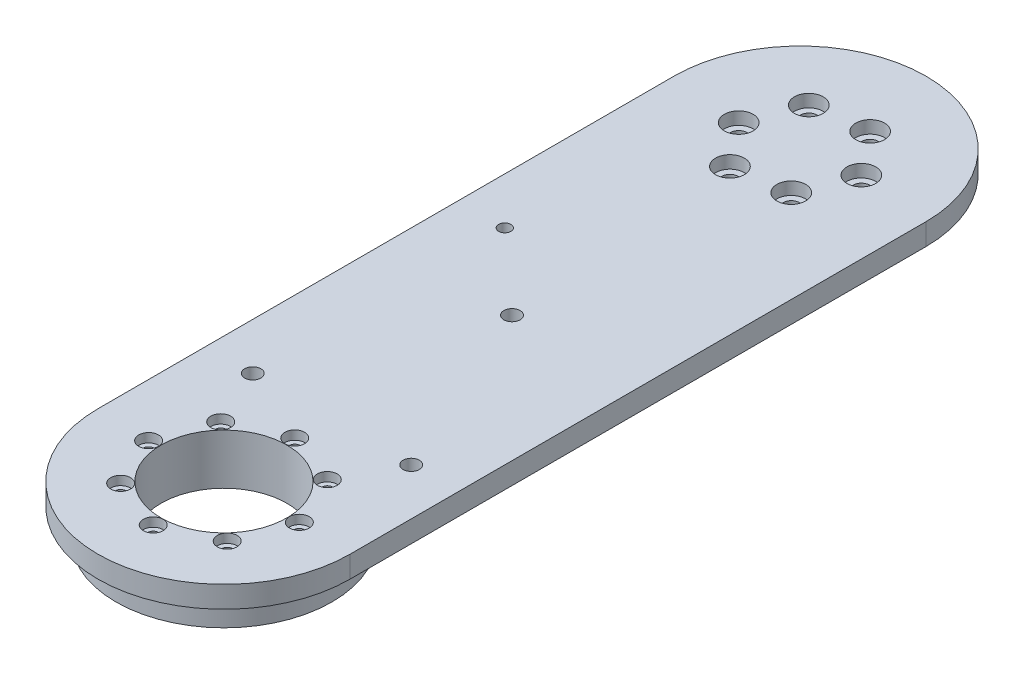
from build123d import *

# Parameters (mm, degrees)
PLACA_START                    = 46.75
SK_PLACA_W                     = 70
SK_PLACA_H                     = 160
PLACA_DEPTH                    = 6
EXTREMOS_START                 = 46.75
SK_EXTREMOS_R                  = 35
EXTREMOS_DEPTH                 = 6
PASANTES_M4_SEPARADORES_START  = 46.75
SK_PASANTES_M4_SEPARADORES_R   = 2.25
PASANTES_M4_SEPARADORES_DEPTH  = 6
ASIENTO_J3_START               = 38.75
SK_ASIENTO_J3_R                = 30
SK_ASIENTO_J3_R_2              = 17.5
ASIENTO_J3_DEPTH               = 8
PASO_ROTOR_J3_START            = 38.75
SK_PASO_ROTOR_J3_R             = 17.5
PASO_ROTOR_J3_DEPTH            = 14
PASANTES_M2_5_ESTATOR_J3_START = 38.75
SK_PASANTES_M2_5_ESTATOR_J3_R  = 1.45
PASANTES_M2_5_ESTATOR_J3_DEPTH = 14
CAJAS_M2_5_J3_START            = 50.25
SK_CAJAS_M2_5_J3_R             = 2.75
CAJAS_M2_5_J3_DEPTH            = 2.5
PASANTES_M4_SALIDA_J2_START    = 46.75
SK_PASANTES_M4_SALIDA_J2_R     = 2.25
PASANTES_M4_SALIDA_J2_DEPTH    = 6
CAJAS_M4_J2_START              = 49.25
SK_CAJAS_M4_J2_R               = 4
CAJAS_M4_J2_DEPTH              = 3.5
PASANTE_M3_CINCHO_START        = 46.75
SK_PASANTE_M3_CINCHO_R         = 1.7
PASANTE_M3_CINCHO_DEPTH        = 6


with BuildPart() as part:
    # Sk_Placa → Placa (new body)
    with BuildSketch(Plane(origin=(0, 0, 0), x_dir=(1, 0, 0), z_dir=(0, 1, 0)).offset(PLACA_START)):
        with Locations((0, -250)):
            Rectangle(SK_PLACA_W, SK_PLACA_H)
    extrude(amount=PLACA_DEPTH)

    # Sk_Extremos → Extremos (add)
    with BuildSketch(Plane(origin=(0, 0, 0), x_dir=(1, 0, 0), z_dir=(0, 1, 0)).offset(EXTREMOS_START)):
        with Locations((0, -170)):
            Circle(SK_EXTREMOS_R)
        with Locations((0, -330)):
            Circle(SK_EXTREMOS_R)
    extrude(amount=EXTREMOS_DEPTH)

    # Sk_Pasantes_M4_separadores → Pasantes_M4_separadores (cut)
    with BuildSketch(Plane(origin=(0, 0, 0), x_dir=(1, 0, 0), z_dir=(0, 1, 0)).offset(PASANTES_M4_SEPARADORES_START)):
        with Locations(Location((0, -250, 0), (0, 0, 270))):
            Circle(SK_PASANTES_M4_SEPARADORES_R)
        with Locations(Location((-22, -300, 0), (0, 0, 270))):
            Circle(SK_PASANTES_M4_SEPARADORES_R)
        with Locations(Location((22, -300, 0), (0, 0, 270))):
            Circle(SK_PASANTES_M4_SEPARADORES_R)
    extrude(amount=PASANTES_M4_SEPARADORES_DEPTH, mode=Mode.SUBTRACT)

    # Sk_Asiento_J3 → Asiento_J3 (add)
    with BuildSketch(Plane(origin=(0, 0, 0), x_dir=(1, 0, 0), z_dir=(0, 1, 0)).offset(ASIENTO_J3_START)):
        with Locations(Location((0, -330, 0), (0, 0, 270))):
            Circle(SK_ASIENTO_J3_R)
        with Locations(Location((0, -330, 0), (0, 0, 270))):
            Circle(SK_ASIENTO_J3_R_2, mode=Mode.SUBTRACT)
    extrude(amount=ASIENTO_J3_DEPTH)

    # Sk_Paso_rotor_J3 → Paso_rotor_J3 (cut)
    with BuildSketch(Plane(origin=(0, 0, 0), x_dir=(1, 0, 0), z_dir=(0, 1, 0)).offset(PASO_ROTOR_J3_START)):
        with Locations(Location((0, -330, 0), (0, 0, 270))):
            Circle(SK_PASO_ROTOR_J3_R)
    extrude(amount=PASO_ROTOR_J3_DEPTH, mode=Mode.SUBTRACT)

    # Sk_Pasantes_M2-5_estator_J3 → Pasantes_M2-5_estator_J3 (cut)
    with BuildSketch(Plane(origin=(0, 0, 0), x_dir=(1, 0, 0), z_dir=(0, 1, 0)).offset(PASANTES_M2_5_ESTATOR_J3_START)):
        with Locations(Location((20.289983175, -329.362361591, 0), (0, 0, 270))):
            Circle(SK_PASANTES_M2_5_ESTATOR_J3_R)
        with Locations(Location((14.798063137, -343.89630625, 0), (0, 0, 270))):
            Circle(SK_PASANTES_M2_5_ESTATOR_J3_R)
        with Locations(Location((0.637638409, -350.289983175, 0), (0, 0, 270))):
            Circle(SK_PASANTES_M2_5_ESTATOR_J3_R)
        with Locations(Location((-13.89630625, -344.798063137, 0), (0, 0, 270))):
            Circle(SK_PASANTES_M2_5_ESTATOR_J3_R)
        with Locations(Location((-20.289983175, -330.637638409, 0), (0, 0, 270))):
            Circle(SK_PASANTES_M2_5_ESTATOR_J3_R)
        with Locations(Location((-14.798063137, -316.10369375, 0), (0, 0, 270))):
            Circle(SK_PASANTES_M2_5_ESTATOR_J3_R)
        with Locations(Location((-0.637638409, -309.710016825, 0), (0, 0, 270))):
            Circle(SK_PASANTES_M2_5_ESTATOR_J3_R)
        with Locations(Location((13.89630625, -315.201936863, 0), (0, 0, 270))):
            Circle(SK_PASANTES_M2_5_ESTATOR_J3_R)
    extrude(amount=PASANTES_M2_5_ESTATOR_J3_DEPTH, mode=Mode.SUBTRACT)

    # Sk_Cajas_M2-5_J3 → Cajas_M2-5_J3 (cut)
    with BuildSketch(Plane(origin=(0, 0, 0), x_dir=(1, 0, 0), z_dir=(0, 1, 0)).offset(CAJAS_M2_5_J3_START)):
        with Locations(Location((20.289983175, -329.362361591, 0), (0, 0, 270))):
            Circle(SK_CAJAS_M2_5_J3_R)
        with Locations(Location((14.798063137, -343.89630625, 0), (0, 0, 270))):
            Circle(SK_CAJAS_M2_5_J3_R)
        with Locations(Location((0.637638409, -350.289983175, 0), (0, 0, 270))):
            Circle(SK_CAJAS_M2_5_J3_R)
        with Locations(Location((-13.89630625, -344.798063137, 0), (0, 0, 270))):
            Circle(SK_CAJAS_M2_5_J3_R)
        with Locations(Location((-20.289983175, -330.637638409, 0), (0, 0, 270))):
            Circle(SK_CAJAS_M2_5_J3_R)
        with Locations(Location((-14.798063137, -316.10369375, 0), (0, 0, 270))):
            Circle(SK_CAJAS_M2_5_J3_R)
        with Locations(Location((-0.637638409, -309.710016825, 0), (0, 0, 270))):
            Circle(SK_CAJAS_M2_5_J3_R)
        with Locations(Location((13.89630625, -315.201936863, 0), (0, 0, 270))):
            Circle(SK_CAJAS_M2_5_J3_R)
    extrude(amount=CAJAS_M2_5_J3_DEPTH, mode=Mode.SUBTRACT)

    # Sk_Pasantes_M4_salida_J2 → Pasantes_M4_salida_J2 (cut)
    with BuildSketch(Plane(origin=(0, 0, 0), x_dir=(1, 0, 0), z_dir=(0, 1, 0)).offset(PASANTES_M4_SALIDA_J2_START)):
        with Locations(Location((14.839084994, -167.808754572, 0), (0, 0, 270))):
            Circle(SK_PASANTES_M4_SALIDA_J2_R)
        with Locations(Location((9.317216704, -181.75540186, 0), (0, 0, 270))):
            Circle(SK_PASANTES_M4_SALIDA_J2_R)
        with Locations(Location((-5.52186829, -183.946647288, 0), (0, 0, 270))):
            Circle(SK_PASANTES_M4_SALIDA_J2_R)
        with Locations(Location((-14.839084994, -172.191245428, 0), (0, 0, 270))):
            Circle(SK_PASANTES_M4_SALIDA_J2_R)
        with Locations(Location((-9.317216704, -158.24459814, 0), (0, 0, 270))):
            Circle(SK_PASANTES_M4_SALIDA_J2_R)
        with Locations(Location((5.52186829, -156.053352712, 0), (0, 0, 270))):
            Circle(SK_PASANTES_M4_SALIDA_J2_R)
    extrude(amount=PASANTES_M4_SALIDA_J2_DEPTH, mode=Mode.SUBTRACT)

    # Sk_Cajas_M4_J2 → Cajas_M4_J2 (cut)
    with BuildSketch(Plane(origin=(0, 0, 0), x_dir=(1, 0, 0), z_dir=(0, 1, 0)).offset(CAJAS_M4_J2_START)):
        with Locations(Location((14.839084994, -167.808754572, 0), (0, 0, 270))):
            Circle(SK_CAJAS_M4_J2_R)
        with Locations(Location((9.317216704, -181.75540186, 0), (0, 0, 270))):
            Circle(SK_CAJAS_M4_J2_R)
        with Locations(Location((-5.52186829, -183.946647288, 0), (0, 0, 270))):
            Circle(SK_CAJAS_M4_J2_R)
        with Locations(Location((-14.839084994, -172.191245428, 0), (0, 0, 270))):
            Circle(SK_CAJAS_M4_J2_R)
        with Locations(Location((-9.317216704, -158.24459814, 0), (0, 0, 270))):
            Circle(SK_CAJAS_M4_J2_R)
        with Locations(Location((5.52186829, -156.053352712, 0), (0, 0, 270))):
            Circle(SK_CAJAS_M4_J2_R)
    extrude(amount=CAJAS_M4_J2_DEPTH, mode=Mode.SUBTRACT)

    # Sk_Pasante_M3_cincho → Pasante_M3_cincho (cut)
    with BuildSketch(Plane(origin=(0, 0, 0), x_dir=(1, 0, 0), z_dir=(0, 1, 0)).offset(PASANTE_M3_CINCHO_START)):
        with Locations(Location((-22, -230, 0), (0, 0, 270))):
            Circle(SK_PASANTE_M3_CINCHO_R)
    extrude(amount=PASANTE_M3_CINCHO_DEPTH, mode=Mode.SUBTRACT)


solid = part.part
